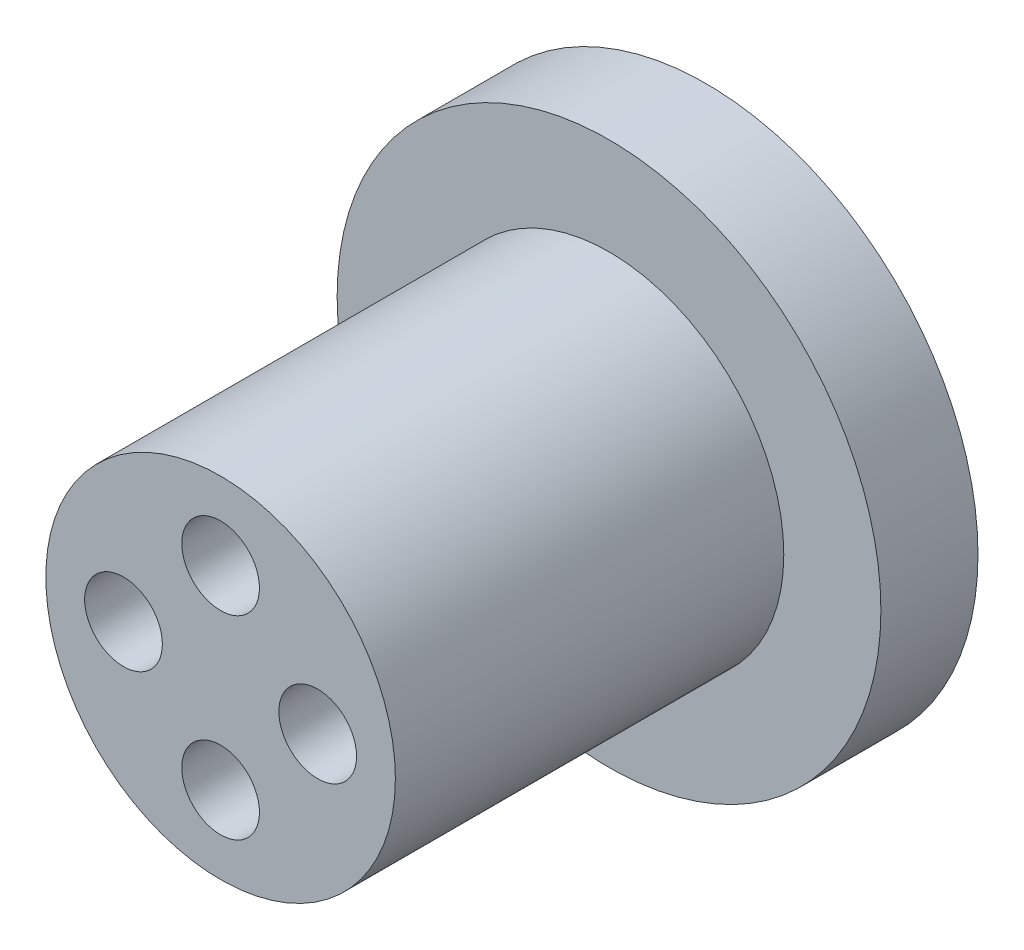
from build123d import *

# Parameters (mm, degrees)
SKETCH1_R           = 7
BOSS_EXTRUDE1_DEPTH = 2.5
SKETCH2_R           = 4.5
BOSS_EXTRUDE2_DEPTH = 10
SKETCH3_R           = 1
CUT_EXTRUDE1_DEPTH  = 5


with BuildPart() as part:
    # Sketch1 → Boss-Extrude1 (new body)
    with BuildSketch(Plane.XY):
        Circle(SKETCH1_R)
    extrude(amount=BOSS_EXTRUDE1_DEPTH)

    # Sketch2 → Boss-Extrude2 (add)
    with BuildSketch(Plane.XY.offset(2.5)):
        Circle(SKETCH2_R)
    extrude(amount=BOSS_EXTRUDE2_DEPTH)

    # Sketch3 → Cut-Extrude1 (cut)
    with BuildSketch(Plane.XY.offset(12.5)):
        with Locations((0, 2.5)):
            Circle(SKETCH3_R)
        with Locations((2.5, 0)):
            Circle(SKETCH3_R)
        with Locations((0, -2.5)):
            Circle(SKETCH3_R)
        with Locations((-2.5, 0)):
            Circle(SKETCH3_R)
    extrude(amount=-CUT_EXTRUDE1_DEPTH, mode=Mode.SUBTRACT)


solid = part.part
